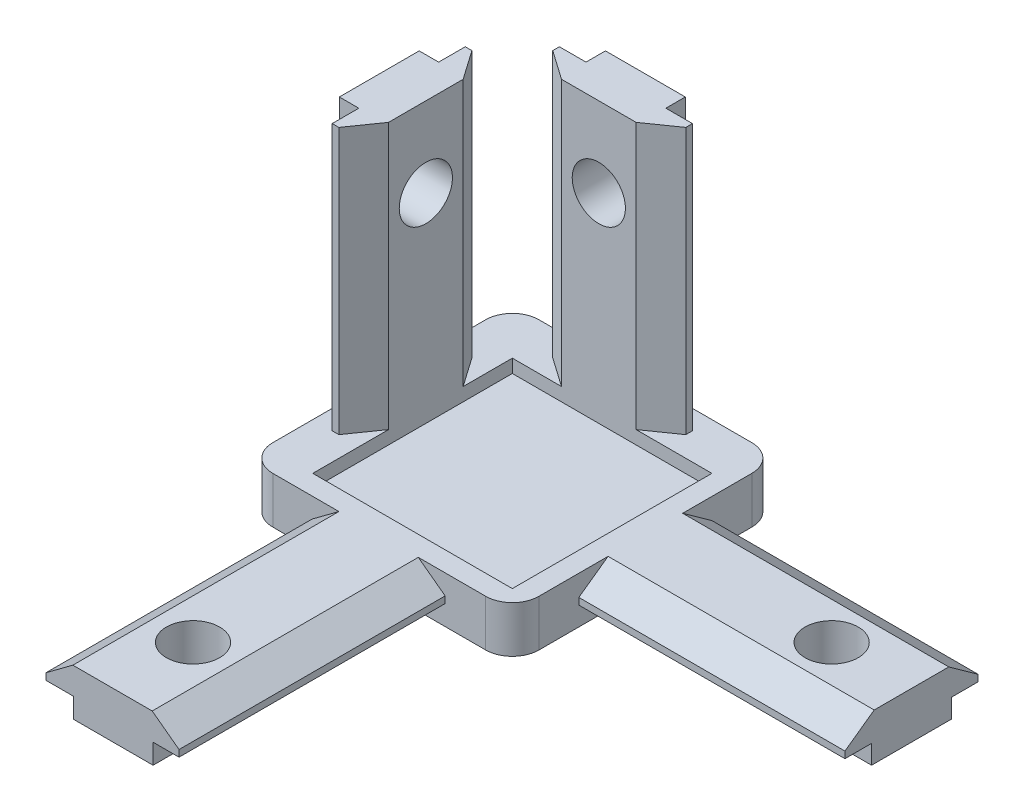
from build123d import *

# Parameters (mm, degrees)
BOSS_EXTRUDE1_DEPTH = 3.5
SKETCH2_W           = 15
SKETCH2_H           = 15
CUT_EXTRUDE1_DEPTH  = 1
BOSS_EXTRUDE2_DEPTH = 20
BOSS_EXTRUDE3_DEPTH = 20
BOSS_EXTRUDE4_DEPTH = 20
SKETCH7_R           = 2
CUT_EXTRUDE3_DEPTH  = 20
SKETCH8_R           = 2
CUT_EXTRUDE4_DEPTH  = 20
SKETCH9_R           = 2
CUT_EXTRUDE5_DEPTH  = 20
SKETCH10_R          = 2
CUT_EXTRUDE6_DEPTH  = 20


with BuildPart() as part:
    # Sketch1 → Boss-Extrude1 (new body)
    with BuildSketch(Plane(origin=(0, 0, 0), x_dir=(1, 0, 0), z_dir=(0, 1, 0))):
        with BuildLine():
            Line((8, -10), (-8, -10))
            ThreePointArc((-8, -10), (-9.414213562, -9.414213562), (-10, -8))
            Line((-10, -8), (-10, 8))
            ThreePointArc((-10, 8), (-9.414213562, 9.414213562), (-8, 10))
            Line((-8, 10), (8, 10))
            ThreePointArc((8, 10), (9.414213562, 9.414213562), (10, 8))
            Line((10, 8), (10, -8))
            ThreePointArc((10, -8), (9.414213562, -9.414213562), (8, -10))
        make_face()
    extrude(amount=BOSS_EXTRUDE1_DEPTH)

    # Sketch2 → Cut-Extrude1 (cut)
    with BuildSketch(Plane(origin=(0, 3.5, 0), x_dir=(1, 0, 0), z_dir=(0, 1, 0))):
        with Locations((1, -1)):
            Rectangle(SKETCH2_W, SKETCH2_H)
    extrude(amount=-CUT_EXTRUDE1_DEPTH, mode=Mode.SUBTRACT)

    # Sketch3 → Boss-Extrude2 (add)
    with BuildSketch(Plane(origin=(0, 3.5, 0), x_dir=(1, 0, 0), z_dir=(0, 1, 0))):
        Polygon((2.803245497, 6.5), (-2.803245497, 6.5), (-5, 8.037515228), (-5, 8.537515228), (-3, 8.537515228), (-3, 10), (3, 10), (3, 8.537515228), (5, 8.537515228), (5, 8.037515228), align=None)
        Polygon((-8.537515228, 5), (-8.037515228, 5), (-6.5, 2.803245497), (-6.5, -2.803245497), (-8.037515228, -5), (-8.537515228, -5), (-8.537515228, -3), (-10, -3), (-10, 3), (-8.537515228, 3), align=None)
    extrude(amount=BOSS_EXTRUDE2_DEPTH)

    # Sketch4 → Boss-Extrude3 (add)
    with BuildSketch(Plane.XY.offset(10)):
        Polygon((2.93267729, 3.5), (4.950797873, 2), (4.950797873, 1.5), (3, 1.5), (3, 0), (-3, 0), (-3, 1.5), (-5.049202127, 1.5), (-5.049202127, 2), (-3.031081545, 3.5), align=None)
    extrude(amount=BOSS_EXTRUDE3_DEPTH)

    # Sketch5 → Boss-Extrude4 (add)
    with BuildSketch(Plane(origin=(10, 0, 0), x_dir=(0, 0, -1), z_dir=(1, 0, 0))):
        Polygon((2.803245497, 3.5), (5, 1.925227615), (5, 1.425227615), (3, 1.425227615), (3, 0), (-3, 0), (-3, 1.425227615), (-5, 1.425227615), (-5, 1.925227615), (-2.803245497, 3.5), align=None)
    extrude(amount=BOSS_EXTRUDE4_DEPTH)

    # Sketch7 → Cut-Extrude3 (cut)
    with BuildSketch(Plane.ZY.offset(10)):
        with Locations((0, 17.5)):
            Circle(SKETCH7_R)
    extrude(amount=-CUT_EXTRUDE3_DEPTH, mode=Mode.SUBTRACT)

    # Sketch8 → Cut-Extrude4 (cut)
    with BuildSketch(Plane(origin=(0, 0, -10), x_dir=(-1, 0, 0), z_dir=(0, 0, -1))):
        with Locations((0, 17.5)):
            Circle(SKETCH8_R)
    extrude(amount=-CUT_EXTRUDE4_DEPTH, mode=Mode.SUBTRACT)

    # Sketch9 → Cut-Extrude5 (cut)
    with BuildSketch(Plane(origin=(0, 3.5, 0), x_dir=(1, 0, 0), z_dir=(0, 1, 0))):
        with Locations(Location((0, -24, 0), (0, 0, 270))):
            Circle(SKETCH9_R)
    extrude(amount=-CUT_EXTRUDE5_DEPTH, mode=Mode.SUBTRACT)

    # Sketch10 → Cut-Extrude6 (cut)
    with BuildSketch(Plane(origin=(0, 3.5, 0), x_dir=(1, 0, 0), z_dir=(0, 1, 0))):
        with Locations(Location((24, 0, 0), (0, 0, 270))):
            Circle(SKETCH10_R)
    extrude(amount=-CUT_EXTRUDE6_DEPTH, mode=Mode.SUBTRACT)


solid = part.part
